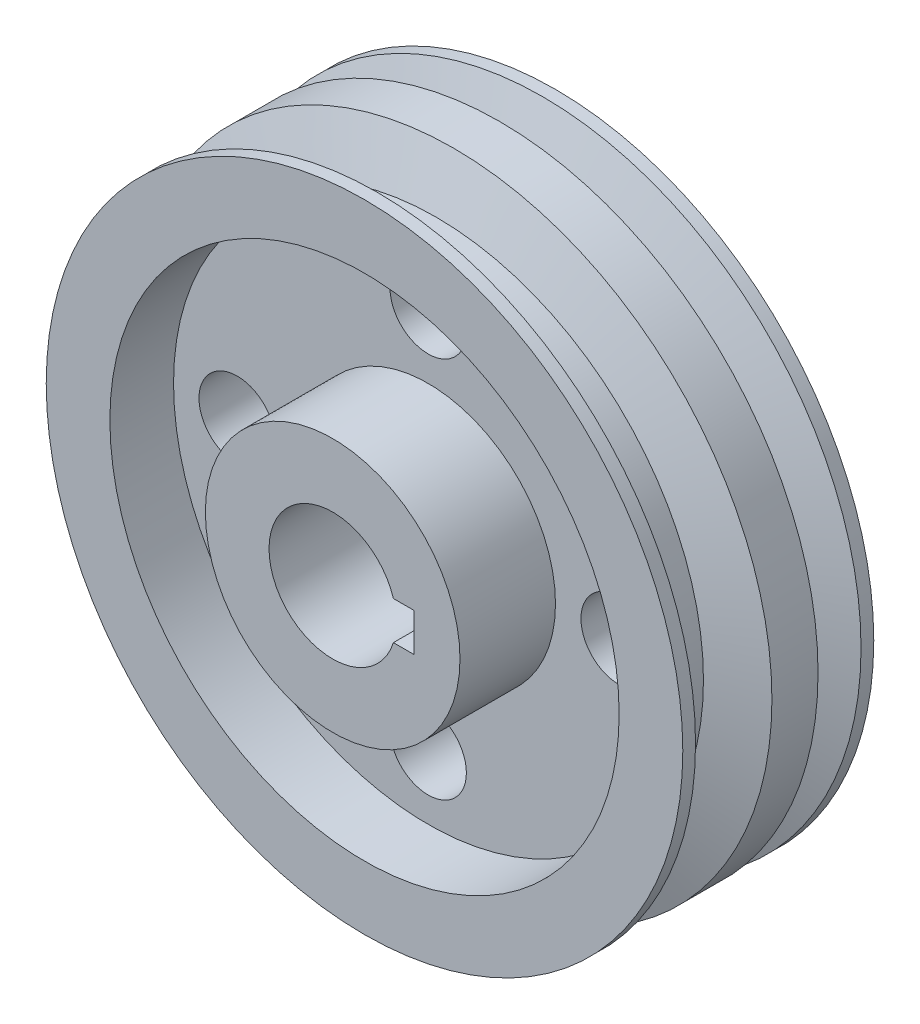
from build123d import *

# Parameters (mm, degrees)
SKETCH_3_W          = 12.8
SKETCH_3_H          = 6
CUT_EXTRUDE_1_DEPTH = 82.240384046
SKETCH_4_R          = 6
CUT_EXTRUDE_2_DEPTH = 82.240384046
SKETCH_5_R          = 10
CUT_EXTRUDE_3_DEPTH = 101


with BuildPart() as part:
    # 草图1 → 旋转1 (revolve)
    with BuildSketch(Plane(origin=(0, 0, 0), x_dir=(1, 0, 0), z_dir=(0, 1, 0)), mode=Mode.PRIVATE) as revolve_1_sk:
        Polygon((0, 20), (20, 20), (20, 5), (40, 5), (40, 15), (50, 15), (50, -15), (40, -15), (40, -5), (20, -5), (20, -20), (0, -20), align=None)
    revolve(revolve_1_sk.sketch.rotate(Axis((0, 0, -20), (0, 0, 1)), 180), axis=Axis((0, 0, -20), (0, 0, 1)))

    # 草图2 → 切除-旋转1 (revolve, cut)
    with BuildSketch(Plane(origin=(0, 0, 0), x_dir=(1, 0, 0), z_dir=(0, 1, 0)), mode=Mode.PRIVATE) as cut_revolve_1_sk:
        Polygon((42, -3.75465), (51, -0.65567), (51, -13.34433), (42, -10.24535), align=None)
        Polygon((42, 3.75465), (51, 6.55567), (51, 13.34433), (42, 10.24535), align=None)
    revolve(cut_revolve_1_sk.sketch.rotate(Axis((0, 0, -20), (0, 0, 1)), 180), axis=Axis((0, 0, -20), (0, 0, 1)), mode=Mode.SUBTRACT)

    # 草图3 → 切除-拉伸1 (cut, through all)
    with BuildSketch(Plane.XY.offset(20)):
        with Locations((6.4, 0)):
            Rectangle(SKETCH_3_W, SKETCH_3_H)
    extrude(amount=-CUT_EXTRUDE_1_DEPTH, mode=Mode.SUBTRACT)

    # 草图4 → 切除-拉伸2 (cut, through all)
    with BuildSketch(Plane.XY.offset(20)):
        with Locations((30, 0)):
            Circle(SKETCH_4_R)
        with Locations((0, 30)):
            Circle(SKETCH_4_R)
        with Locations((-30, 0)):
            Circle(SKETCH_4_R)
        with Locations((0, -30)):
            Circle(SKETCH_4_R)
    extrude(amount=-CUT_EXTRUDE_2_DEPTH, mode=Mode.SUBTRACT)

    # 草图5 → 切除-拉伸3 (cut, symmetric)
    with BuildSketch(Plane.XY.offset(20)):
        Circle(SKETCH_5_R)
    extrude(amount=CUT_EXTRUDE_3_DEPTH, both=True, mode=Mode.SUBTRACT)


solid = part.part
